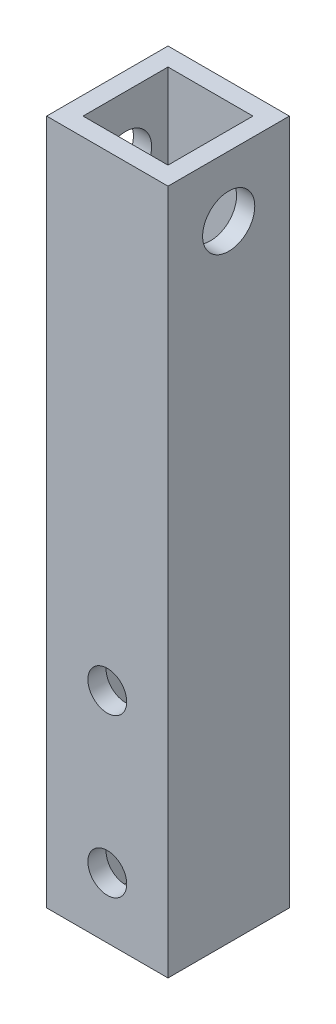
from build123d import *

# Parameters (mm, degrees)
SKETCH_1_W          = 10
SKETCH_1_H          = 10
SKETCH_1_W_2        = 7
SKETCH_1_H_2        = 7
EXTRUDE_1_DEPTH     = 56.5
SKETCH_2_R          = 1.6
CUT_EXTRUDE_1_DEPTH = 58.595572747
SKETCH_3_R          = 2.15
CUT_EXTRUDE_2_DEPTH = 58.595572747


with BuildPart() as part:
    # ｽｹｯﾁ1 → 押し出し-薄板1 (new body)
    with BuildSketch(Plane(origin=(0, 0, 0), x_dir=(1, 0, 0), z_dir=(0, 1, 0))):
        Rectangle(SKETCH_1_W, SKETCH_1_H)
        Rectangle(SKETCH_1_W_2, SKETCH_1_H_2, mode=Mode.SUBTRACT)
    extrude(amount=EXTRUDE_1_DEPTH)

    # ｽｹｯﾁ2 → ｶｯﾄ - 押し出し1 (cut, through all)
    with BuildSketch(Plane.XY.offset(5)):
        with Locations((0, 18)):
            Circle(SKETCH_2_R)
        with Locations((0, 5)):
            Circle(SKETCH_2_R)
    extrude(amount=-CUT_EXTRUDE_1_DEPTH, mode=Mode.SUBTRACT)

    # ｽｹｯﾁ3 → ｶｯﾄ - 押し出し2 (cut, through all)
    with BuildSketch(Plane(origin=(5, 0, 0), x_dir=(0, 0, -1), z_dir=(1, 0, 0))):
        with Locations((0, 51.5)):
            Circle(SKETCH_3_R)
    extrude(amount=-CUT_EXTRUDE_2_DEPTH, mode=Mode.SUBTRACT)


solid = part.part
